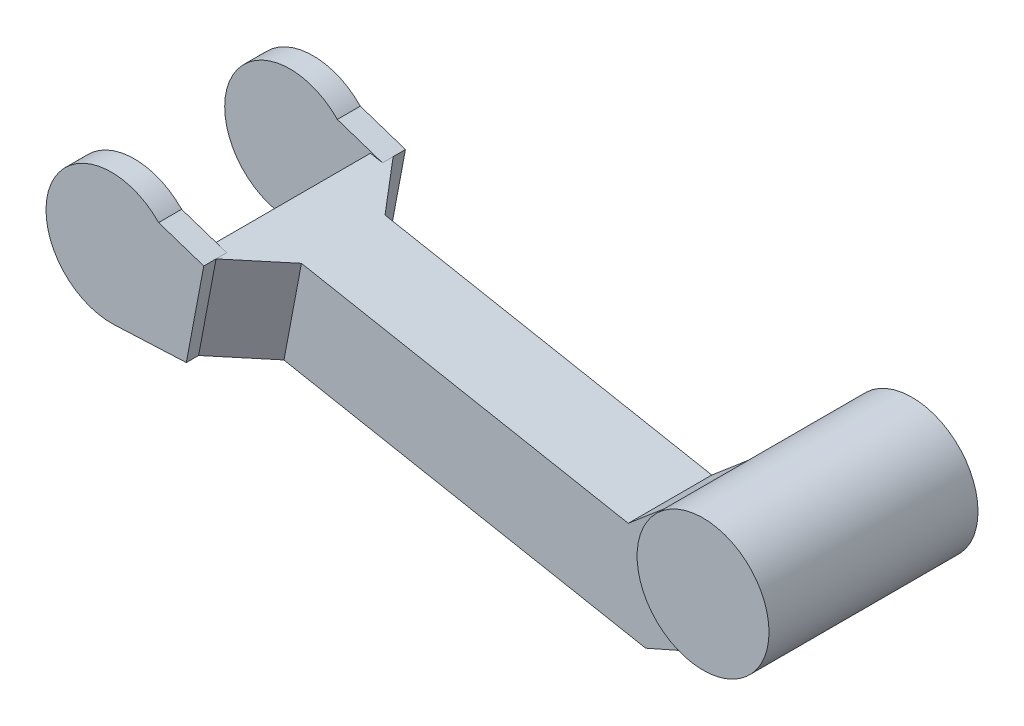
from build123d import *

# Parameters (mm, degrees)
BOSS_EXTRUDE1_DEPTH      = 0.05
BOSS_EXTRUDE1_DEPTH_BACK = 0.05
SKETCH1_R                = 0.031555485
BOSS_EXTRUDE2_DEPTH      = 0.02
BOSS_EXTRUDE2_DEPTH_BACK = 0.02
BOSS_EXTRUDE3_DEPTH      = 0.045
BOSS_EXTRUDE4_START      = 0.037
BOSS_EXTRUDE4_DEPTH      = 0.011
BOSS_EXTRUDE5_START      = -0.0485
BOSS_EXTRUDE5_DEPTH      = 0.011


with BuildPart() as part:
    # Sketch1 → Boss-Extrude1 (new, two sides: drawn at the far end of the back side and taken through both)
    with BuildSketch(Plane.XY.offset(-BOSS_EXTRUDE1_DEPTH_BACK)):
        with Locations((0.285082825, 0)):
            Circle(SKETCH1_R)
    extrude(amount=BOSS_EXTRUDE1_DEPTH + BOSS_EXTRUDE1_DEPTH_BACK)

    # Sketch2 → Boss-Extrude2 (add, two sides: drawn at the far end of the back side and taken through both)
    with BuildSketch(Plane.XY.offset(-BOSS_EXTRUDE2_DEPTH_BACK)):
        Polygon((0.256264101, 0.012854173), (0.219275504, -0.018570175), (0.038999203, 0.01549308), (0.029362086, -0.028537173), (0.227597753, -0.066155863), (0.28991637, -0.038647294), (0.305214712, -0.024299296), align=None)
    extrude(amount=BOSS_EXTRUDE2_DEPTH + BOSS_EXTRUDE2_DEPTH_BACK)

    # Sketch4 → Boss-Extrude3 (add)
    with BuildSketch(Plane(origin=(0.00417087, 0.022073903, 0), x_dir=(0.9826131004203594, -0.18566500715613823, 0), z_dir=(0.18566500715613823, 0.9826131004203594, 0))):
        Polygon((0.034871537, 0.042595926), (0.034871537, -0.042120531), (0.040720148, -0.042120531), (0.059784705, -0.02), (0.059784705, 0.02), (0.040720148, 0.042595926), align=None)
    extrude(amount=-BOSS_EXTRUDE3_DEPTH)

    # Sketch5 → Boss-Extrude4 (add)
    with BuildSketch(Plane.XY.offset(BOSS_EXTRUDE4_START)):
        with BuildLine():
            Line((0.001433832, -0.031280551), (0.035828096, -0.029703994))
            Line((0.035828096, -0.029703994), (0.044183021, 0.014513596))
            Line((0.044183021, 0.014513596), (0.022579642, 0.021695356))
            ThreePointArc((0.022579642, 0.021695356), (-0.029082184, 0.011608416), (0.001433832, -0.031280551))
        make_face()
    extrude(amount=BOSS_EXTRUDE4_DEPTH)

    # Sketch5<2> → Boss-Extrude5 (add)
    with BuildSketch(Plane.XY.offset(BOSS_EXTRUDE5_START)):
        with BuildLine():
            Line((0.001433832, -0.031280551), (0.035828096, -0.029703994))
            Line((0.035828096, -0.029703994), (0.044183021, 0.014513596))
            Line((0.044183021, 0.014513596), (0.022579642, 0.021695356))
            ThreePointArc((0.022579642, 0.021695356), (-0.029082184, 0.011608416), (0.001433832, -0.031280551))
        make_face()
    extrude(amount=BOSS_EXTRUDE5_DEPTH)


solid = part.part
